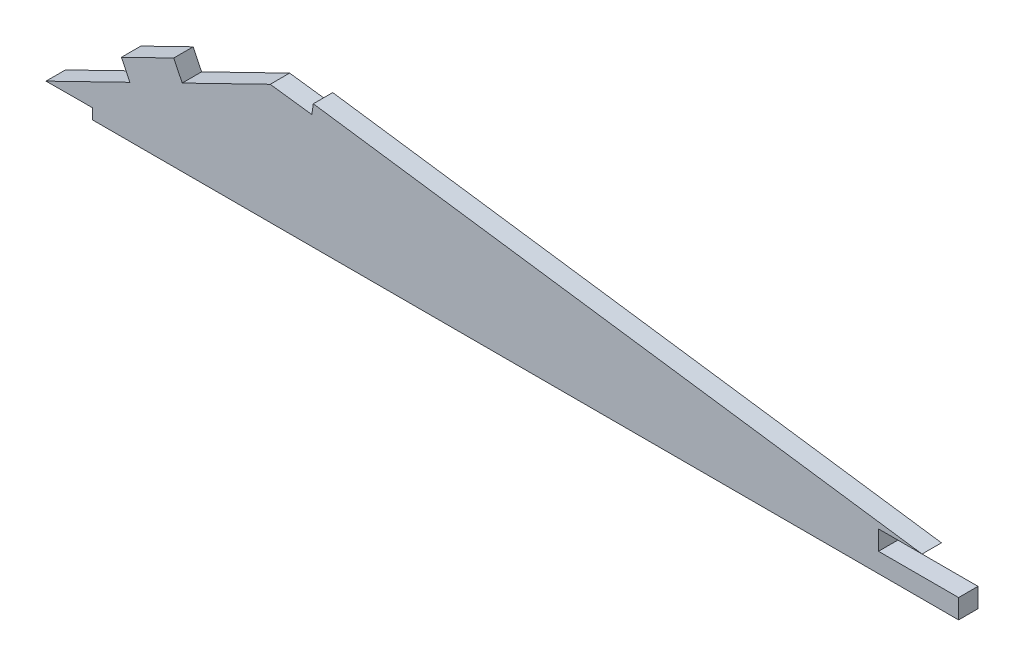
from build123d import *

# Parameters (mm, degrees)
EXTRUDE_1_DEPTH = 2


with BuildPart() as part:
    # Model → 凸台-拉伸1 (new body)
    with BuildSketch(Plane.XY):
        Polygon((10.873938388, 9.300968981), (9.997196094, 11.098557074), (15.389960372, 13.728783954), (16.266702666, 11.931195862), (25.33608429, 16.354628838), (29.630309914, 15.799177404), (29.778519967, 16.836869662), (92.531757755, 8.017477243), (88.04213964, 8.017477243), (88.04213964, 6.017477243), (96.298316036, 6.017477243), (96.298316036, 4.017477243), (7.009613909, 4.017477243), (7.005410285, 5.100641335), (2.223944486, 5.082085064), align=None)
    extrude(amount=EXTRUDE_1_DEPTH)


solid = part.part
